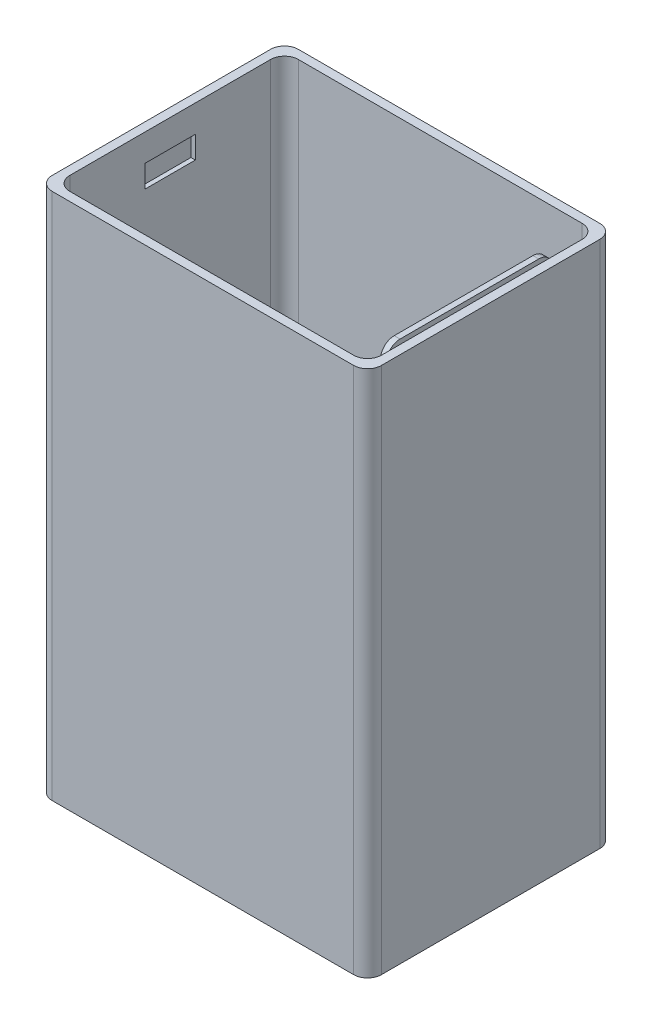
from build123d import *

# Parameters (mm, degrees)
SKETCH1_W           = 237.6932
SKETCH1_H           = 177.6984
SKETCH1_W_2         = 224.9932
SKETCH1_H_2         = 164.9984
BOSS_EXTRUDE1_DEPTH = 374.65
SKETCH4_W           = 107.442
SKETCH4_H           = 374.65
BOSS_EXTRUDE2_DEPTH = 9.017
SKETCH5_W           = 120.142
SKETCH5_H           = 374.65
BOSS_EXTRUDE3_DEPTH = 4.191
SKETCH7_W           = 9.017
SKETCH7_H           = 107.442
CUT_EXTRUDE1_DEPTH  = 21.59
SKETCH10_W          = 4.191
SKETCH10_H          = 120.142
CUT_EXTRUDE2_DEPTH  = 5.588
FILLET1_R           = 10
FILLET2_R           = 10
FILLET3_R           = 10
FILLET4_R           = 10
FILLET5_R           = 10
FILLET6_R           = 10
FILLET7_R           = 10
SKETCH11_W          = 50.8
SKETCH11_H          = 15.24
BOSS_EXTRUDE4_DEPTH = 19.9898
FILLET10_R          = 10
FILLET11_R          = 10
BOSS_EXTRUDE5_DEPTH = 6.35
FILLET13_R          = 10
SKETCH13_W          = 36.3982
SKETCH13_H          = 16.129
CUT_EXTRUDE4_DEPTH  = 3.175
CUT_EXTRUDE5_DEPTH  = 6.35


with BuildPart() as part:
    # Sketch1 → Boss-Extrude1 (new body)
    with BuildSketch(Plane(origin=(0, 0, 0), x_dir=(1, 0, 0), z_dir=(0, 1, 0))):
        with Locations((112.4966, -82.4992)):
            Rectangle(SKETCH1_W, SKETCH1_H)
        with Locations((112.4966, -82.4992)):
            Rectangle(SKETCH1_W_2, SKETCH1_H_2, mode=Mode.SUBTRACT)
    extrude(amount=BOSS_EXTRUDE1_DEPTH)

    # Sketch4 → Boss-Extrude2 (add)
    with BuildSketch(Plane.ZY.offset(-224.9932)):
        with Locations((82.4484, 187.325)):
            Rectangle(SKETCH4_W, SKETCH4_H)
    extrude(amount=BOSS_EXTRUDE2_DEPTH)

    # Sketch5 → Boss-Extrude3 (add)
    with BuildSketch(Plane.ZY.offset(-215.9762)):
        with Locations((82.4484, 187.325)):
            Rectangle(SKETCH5_W, SKETCH5_H)
    extrude(amount=BOSS_EXTRUDE3_DEPTH)

    # Sketch7 → Cut-Extrude1 (cut)
    with BuildSketch(Plane(origin=(0, 374.65, 0), x_dir=(1, 0, 0), z_dir=(0, 1, 0))):
        with Locations((220.4847, -82.4484)):
            Rectangle(SKETCH7_W, SKETCH7_H)
    extrude(amount=-CUT_EXTRUDE1_DEPTH, mode=Mode.SUBTRACT)

    # Sketch10 → Cut-Extrude2 (cut)
    with BuildSketch(Plane(origin=(0, 374.65, 0), x_dir=(1, 0, 0), z_dir=(0, 1, 0))):
        with Locations((213.8807, -82.4484)):
            Rectangle(SKETCH10_W, SKETCH10_H)
    extrude(amount=-CUT_EXTRUDE2_DEPTH, mode=Mode.SUBTRACT)

    # Fillet1
    fillet1_edges = [part.edges().sort_by_distance(p)[0] for p in [
        (231.3432, 187.325, 171.3484),
    ]]
    fillet(fillet1_edges, radius=FILLET1_R)

    # Fillet2
    fillet2_edges = [part.edges().sort_by_distance(p)[0] for p in [
        (224.9932, 187.325, 164.9984),
    ]]
    fillet(fillet2_edges, radius=FILLET2_R)

    # Fillet3
    fillet3_edges = [part.edges().sort_by_distance(p)[0] for p in [
        (224.9932, 187.325, 0),
        (231.3432, 187.325, -6.35),
    ]]
    fillet(fillet3_edges, radius=FILLET3_R)

    # Fillet4
    fillet4_edges = [part.edges().sort_by_distance(p)[0] for p in [
        (0, 187.325, 164.9984),
        (-6.35, 187.325, 171.3484),
    ]]
    fillet(fillet4_edges, radius=FILLET4_R)

    # Fillet5
    fillet5_edges = [part.edges().sort_by_distance(p)[0] for p in [
        (0, 187.325, 0),
        (-6.35, 187.325, -6.35),
    ]]
    fillet(fillet5_edges, radius=FILLET5_R)

    # Fillet6
    fillet6_edges = [part.edges().sort_by_distance(p)[0] for p in [
        (220.4847, 353.06, 28.7274),
        (220.4847, 353.06, 136.1694),
    ]]
    fillet(fillet6_edges, radius=FILLET6_R)

    # Fillet7
    fillet7_edges = [part.edges().sort_by_distance(p)[0] for p in [
        (213.8807, 369.062, 22.3774),
        (213.8807, 369.062, 142.5194),
    ]]
    fillet(fillet7_edges, radius=FILLET7_R)

    # Sketch11 → Boss-Extrude4 (add)
    with BuildSketch(Plane.ZY.offset(-211.7852)):
        with Locations((82.4484, 7.62)):
            Rectangle(SKETCH11_W, SKETCH11_H)
    extrude(amount=BOSS_EXTRUDE4_DEPTH)

    # Fillet10
    fillet10_edges = [part.edges().sort_by_distance(p)[0] for p in [
        (191.7954, 7.62, 57.0484),
        (191.7954, 7.62, 107.8484),
    ]]
    fillet(fillet10_edges, radius=FILLET10_R)

    # Fillet11
    fillet11_edges = [part.edges().sort_by_distance(p)[0] for p in [
        (191.7954, 15.24, 82.4484),
        (206.7903, 15.24, 57.0484),
        (206.7903, 15.24, 107.8484),
        (194.724332188, 15.24, 59.977332188),
        (194.724332188, 15.24, 104.919467812),
    ]]
    fillet(fillet11_edges, radius=FILLET11_R)

    # Sketch12 → Boss-Extrude5 (add)
    with BuildSketch(Plane.XZ):
        with BuildLine():
            Line((231.3432, 161.3484), (231.3432, 3.65))
            ThreePointArc((231.3432, 3.65), (228.414267812, -3.421067812), (221.3432, -6.35))
            Line((221.3432, -6.35), (3.65, -6.35))
            ThreePointArc((3.65, -6.35), (-3.421067812, -3.421067812), (-6.35, 3.65))
            Line((-6.35, 3.65), (-6.35, 161.3484))
            ThreePointArc((-6.35, 161.3484), (-3.421067812, 168.419467812), (3.65, 171.3484))
            Line((3.65, 171.3484), (221.3432, 171.3484))
            ThreePointArc((221.3432, 171.3484), (228.414267812, 168.419467812), (231.3432, 161.3484))
        make_face()
    extrude(amount=BOSS_EXTRUDE5_DEPTH)

    # Fillet13
    fillet13_edges = [part.edges().sort_by_distance(p)[0] for p in [
        (224.9932, 0, 19.3637),
        (222.064267812, 0, 2.928932188),
        (112.4966, 0, 0),
        (2.928932188, 0, 2.928932188),
        (224.9932, 0, 145.5839),
        (222.064267812, 0, 162.069467812),
        (112.4966, 0, 164.9984),
        (2.928932188, 0, 162.069467812),
        (0, 0, 82.4992),
    ]]
    fillet(fillet13_edges, radius=FILLET13_R)

    # Sketch13 → Cut-Extrude4 (cut)
    with BuildSketch(Plane(origin=(0, 0, 0), x_dir=(0, 0, -1), z_dir=(1, 0, 0))):
        with Locations((-82.5551, 346.9767)):
            Rectangle(SKETCH13_W, SKETCH13_H)
    extrude(amount=-CUT_EXTRUDE4_DEPTH, mode=Mode.SUBTRACT)

    # Sketch15 → Cut-Extrude5 (cut)
    with BuildSketch(Plane.XZ.offset(6.35)):
        Polygon((177.8, 131.139877372), (184.15, 134.806051581), (184.15, 142.1384), (177.8, 145.80457421), (171.45, 142.1384), (171.45, 134.806051581), align=None)
        Polygon((196.85, 131.139877372), (203.2, 134.806051581), (203.2, 142.1384), (196.85, 145.80457421), (190.5, 142.1384), (190.5, 134.806051581), align=None)
        Polygon((158.75, 131.139877372), (165.1, 134.806051581), (165.1, 142.1384), (158.75, 145.80457421), (152.4, 142.1384), (152.4, 134.806051581), align=None)
        Polygon((139.7, 131.139877372), (146.05, 134.806051581), (146.05, 142.1384), (139.7, 145.80457421), (133.35, 142.1384), (133.35, 134.806051581), align=None)
        Polygon((120.65, 131.139877372), (127, 134.806051581), (127, 142.1384), (120.65, 145.80457421), (114.3, 142.1384), (114.3, 134.806051581), align=None)
        Polygon((101.6, 131.139877372), (107.95, 134.806051581), (107.95, 142.1384), (101.6, 145.80457421), (95.25, 142.1384), (95.25, 134.806051581), align=None)
        Polygon((82.55, 131.139877372), (88.9, 134.806051581), (88.9, 142.1384), (82.55, 145.80457421), (76.2, 142.1384), (76.2, 134.806051581), align=None)
        Polygon((63.5, 131.139877372), (69.85, 134.806051581), (69.85, 142.1384), (63.5, 145.80457421), (57.15, 142.1384), (57.15, 134.806051581), align=None)
        Polygon((44.45, 131.139877372), (50.8, 134.806051581), (50.8, 142.1384), (44.45, 145.80457421), (38.1, 142.1384), (38.1, 134.806051581), align=None)
        Polygon((25.4, 131.139877372), (31.75, 134.806051581), (31.75, 142.1384), (25.4, 145.80457421), (19.05, 142.1384), (19.05, 134.806051581), align=None)
        Polygon((32.471566581, 113.225602985), (38.821566581, 116.891777194), (38.821566581, 124.224125613), (32.471566581, 127.890299822), (26.121566581, 124.224125613), (26.121566581, 116.891777194), align=None)
        Polygon((51.521566581, 113.225602985), (57.871566581, 116.891777194), (57.871566581, 124.224125613), (51.521566581, 127.890299822), (45.171566581, 124.224125613), (45.171566581, 116.891777194), align=None)
        Polygon((70.571566581, 113.225602985), (76.921566581, 116.891777194), (76.921566581, 124.224125613), (70.571566581, 127.890299822), (64.221566581, 124.224125613), (64.221566581, 116.891777194), align=None)
        Polygon((89.621566581, 113.225602985), (95.971566581, 116.891777194), (95.971566581, 124.224125613), (89.621566581, 127.890299822), (83.271566581, 124.224125613), (83.271566581, 116.891777194), align=None)
        Polygon((108.671566581, 113.225602985), (115.021566581, 116.891777194), (115.021566581, 124.224125613), (108.671566581, 127.890299822), (102.321566581, 124.224125613), (102.321566581, 116.891777194), align=None)
        Polygon((127.721566581, 113.225602985), (134.071566581, 116.891777194), (134.071566581, 124.224125613), (127.721566581, 127.890299822), (121.371566581, 124.224125613), (121.371566581, 116.891777194), align=None)
        Polygon((146.771566581, 113.225602985), (153.121566581, 116.891777194), (153.121566581, 124.224125613), (146.771566581, 127.890299822), (140.421566581, 124.224125613), (140.421566581, 116.891777194), align=None)
        Polygon((165.821566581, 113.225602985), (172.171566581, 116.891777194), (172.171566581, 124.224125613), (165.821566581, 127.890299822), (159.471566581, 124.224125613), (159.471566581, 116.891777194), align=None)
        Polygon((184.871566581, 113.225602985), (191.221566581, 116.891777194), (191.221566581, 124.224125613), (184.871566581, 127.890299822), (178.521566581, 124.224125613), (178.521566581, 116.891777194), align=None)
        Polygon((25.4, 95.311328598), (31.75, 98.977502807), (31.75, 106.309851226), (25.4, 109.976025435), (19.05, 106.309851226), (19.05, 98.977502807), align=None)
        Polygon((44.45, 95.311328598), (50.8, 98.977502807), (50.8, 106.309851226), (44.45, 109.976025435), (38.1, 106.309851226), (38.1, 98.977502807), align=None)
        Polygon((63.5, 95.311328598), (69.85, 98.977502807), (69.85, 106.309851226), (63.5, 109.976025435), (57.15, 106.309851226), (57.15, 98.977502807), align=None)
        Polygon((82.55, 95.311328598), (88.9, 98.977502807), (88.9, 106.309851226), (82.55, 109.976025435), (76.2, 106.309851226), (76.2, 98.977502807), align=None)
        Polygon((101.6, 95.311328598), (107.95, 98.977502807), (107.95, 106.309851226), (101.6, 109.976025435), (95.25, 106.309851226), (95.25, 98.977502807), align=None)
        Polygon((120.65, 95.311328598), (127, 98.977502807), (127, 106.309851226), (120.65, 109.976025435), (114.3, 106.309851226), (114.3, 98.977502807), align=None)
        Polygon((139.7, 95.311328598), (146.05, 98.977502807), (146.05, 106.309851226), (139.7, 109.976025435), (133.35, 106.309851226), (133.35, 98.977502807), align=None)
        Polygon((158.75, 95.311328598), (165.1, 98.977502807), (165.1, 106.309851226), (158.75, 109.976025435), (152.4, 106.309851226), (152.4, 98.977502807), align=None)
        Polygon((177.8, 95.311328598), (184.15, 98.977502807), (184.15, 106.309851226), (177.8, 109.976025435), (171.45, 106.309851226), (171.45, 98.977502807), align=None)
        Polygon((184.871566581, 77.397054211), (191.221566581, 81.06322842), (191.221566581, 88.395576839), (184.871566581, 92.061751048), (178.521566581, 88.395576839), (178.521566581, 81.06322842), align=None)
        Polygon((165.821566581, 77.397054211), (172.171566581, 81.06322842), (172.171566581, 88.395576839), (165.821566581, 92.061751048), (159.471566581, 88.395576839), (159.471566581, 81.06322842), align=None)
        Polygon((146.771566581, 77.397054211), (153.121566581, 81.06322842), (153.121566581, 88.395576839), (146.771566581, 92.061751048), (140.421566581, 88.395576839), (140.421566581, 81.06322842), align=None)
        Polygon((127.721566581, 77.397054211), (134.071566581, 81.06322842), (134.071566581, 88.395576839), (127.721566581, 92.061751048), (121.371566581, 88.395576839), (121.371566581, 81.06322842), align=None)
        Polygon((108.671566581, 77.397054211), (115.021566581, 81.06322842), (115.021566581, 88.395576839), (108.671566581, 92.061751048), (102.321566581, 88.395576839), (102.321566581, 81.06322842), align=None)
        Polygon((89.621566581, 77.397054211), (95.971566581, 81.06322842), (95.971566581, 88.395576839), (89.621566581, 92.061751048), (83.271566581, 88.395576839), (83.271566581, 81.06322842), align=None)
        Polygon((70.571566581, 77.397054211), (76.921566581, 81.06322842), (76.921566581, 88.395576839), (70.571566581, 92.061751048), (64.221566581, 88.395576839), (64.221566581, 81.06322842), align=None)
        Polygon((51.521566581, 77.397054211), (57.871566581, 81.06322842), (57.871566581, 88.395576839), (51.521566581, 92.061751048), (45.171566581, 88.395576839), (45.171566581, 81.06322842), align=None)
        Polygon((32.471566581, 77.397054211), (38.821566581, 81.06322842), (38.821566581, 88.395576839), (32.471566581, 92.061751048), (26.121566581, 88.395576839), (26.121566581, 81.06322842), align=None)
        Polygon((25.4, 59.482779824), (31.75, 63.148954033), (31.75, 70.481302452), (25.4, 74.147476661), (19.05, 70.481302452), (19.05, 63.148954033), align=None)
        Polygon((44.45, 59.482779824), (50.8, 63.148954033), (50.8, 70.481302452), (44.45, 74.147476661), (38.1, 70.481302452), (38.1, 63.148954033), align=None)
        Polygon((63.5, 59.482779824), (69.85, 63.148954033), (69.85, 70.481302452), (63.5, 74.147476661), (57.15, 70.481302452), (57.15, 63.148954033), align=None)
        Polygon((82.55, 59.482779824), (88.9, 63.148954033), (88.9, 70.481302452), (82.55, 74.147476661), (76.2, 70.481302452), (76.2, 63.148954033), align=None)
        Polygon((101.6, 59.482779824), (107.95, 63.148954033), (107.95, 70.481302452), (101.6, 74.147476661), (95.25, 70.481302452), (95.25, 63.148954033), align=None)
        Polygon((120.65, 59.482779824), (127, 63.148954033), (127, 70.481302452), (120.65, 74.147476661), (114.3, 70.481302452), (114.3, 63.148954033), align=None)
        Polygon((139.7, 59.482779824), (146.05, 63.148954033), (146.05, 70.481302452), (139.7, 74.147476661), (133.35, 70.481302452), (133.35, 63.148954033), align=None)
        Polygon((158.75, 59.482779824), (165.1, 63.148954033), (165.1, 70.481302452), (158.75, 74.147476661), (152.4, 70.481302452), (152.4, 63.148954033), align=None)
        Polygon((177.8, 59.482779824), (184.15, 63.148954033), (184.15, 70.481302452), (177.8, 74.147476661), (171.45, 70.481302452), (171.45, 63.148954033), align=None)
        Polygon((184.871566581, 41.568505436), (191.221566581, 45.234679646), (191.221566581, 52.567028064), (184.871566581, 56.233202274), (178.521566581, 52.567028064), (178.521566581, 45.234679646), align=None)
        Polygon((165.821566581, 41.568505436), (172.171566581, 45.234679646), (172.171566581, 52.567028064), (165.821566581, 56.233202274), (159.471566581, 52.567028064), (159.471566581, 45.234679646), align=None)
        Polygon((146.771566581, 41.568505436), (153.121566581, 45.234679646), (153.121566581, 52.567028064), (146.771566581, 56.233202274), (140.421566581, 52.567028064), (140.421566581, 45.234679646), align=None)
        Polygon((127.721566581, 41.568505436), (134.071566581, 45.234679646), (134.071566581, 52.567028064), (127.721566581, 56.233202274), (121.371566581, 52.567028064), (121.371566581, 45.234679646), align=None)
        Polygon((108.671566581, 41.568505436), (115.021566581, 45.234679646), (115.021566581, 52.567028064), (108.671566581, 56.233202274), (102.321566581, 52.567028064), (102.321566581, 45.234679646), align=None)
        Polygon((89.621566581, 41.568505436), (95.971566581, 45.234679646), (95.971566581, 52.567028064), (89.621566581, 56.233202274), (83.271566581, 52.567028064), (83.271566581, 45.234679646), align=None)
        Polygon((70.571566581, 41.568505436), (76.921566581, 45.234679646), (76.921566581, 52.567028064), (70.571566581, 56.233202274), (64.221566581, 52.567028064), (64.221566581, 45.234679646), align=None)
        Polygon((51.521566581, 41.568505436), (57.871566581, 45.234679646), (57.871566581, 52.567028064), (51.521566581, 56.233202274), (45.171566581, 52.567028064), (45.171566581, 45.234679646), align=None)
        Polygon((32.471566581, 41.568505436), (38.821566581, 45.234679646), (38.821566581, 52.567028064), (32.471566581, 56.233202274), (26.121566581, 52.567028064), (26.121566581, 45.234679646), align=None)
        Polygon((25.4, 23.654231049), (31.75, 27.320405259), (31.75, 34.652753677), (25.4, 38.318927887), (19.05, 34.652753677), (19.05, 27.320405259), align=None)
        Polygon((44.45, 23.654231049), (50.8, 27.320405259), (50.8, 34.652753677), (44.45, 38.318927887), (38.1, 34.652753677), (38.1, 27.320405259), align=None)
        Polygon((63.5, 23.654231049), (69.85, 27.320405259), (69.85, 34.652753677), (63.5, 38.318927887), (57.15, 34.652753677), (57.15, 27.320405259), align=None)
        Polygon((82.55, 23.654231049), (88.9, 27.320405259), (88.9, 34.652753677), (82.55, 38.318927887), (76.2, 34.652753677), (76.2, 27.320405259), align=None)
        Polygon((101.6, 23.654231049), (107.95, 27.320405259), (107.95, 34.652753677), (101.6, 38.318927887), (95.25, 34.652753677), (95.25, 27.320405259), align=None)
        Polygon((120.65, 23.654231049), (127, 27.320405259), (127, 34.652753677), (120.65, 38.318927887), (114.3, 34.652753677), (114.3, 27.320405259), align=None)
        Polygon((139.7, 23.654231049), (146.05, 27.320405259), (146.05, 34.652753677), (139.7, 38.318927887), (133.35, 34.652753677), (133.35, 27.320405259), align=None)
        Polygon((158.75, 23.654231049), (165.1, 27.320405259), (165.1, 34.652753677), (158.75, 38.318927887), (152.4, 34.652753677), (152.4, 27.320405259), align=None)
        Polygon((177.8, 23.654231049), (184.15, 27.320405259), (184.15, 34.652753677), (177.8, 38.318927887), (171.45, 34.652753677), (171.45, 27.320405259), align=None)
        Polygon((196.85, 23.654231049), (203.2, 27.320405259), (203.2, 34.652753677), (196.85, 38.318927887), (190.5, 34.652753677), (190.5, 27.320405259), align=None)
    extrude(amount=-CUT_EXTRUDE5_DEPTH, mode=Mode.SUBTRACT)


solid = part.part
